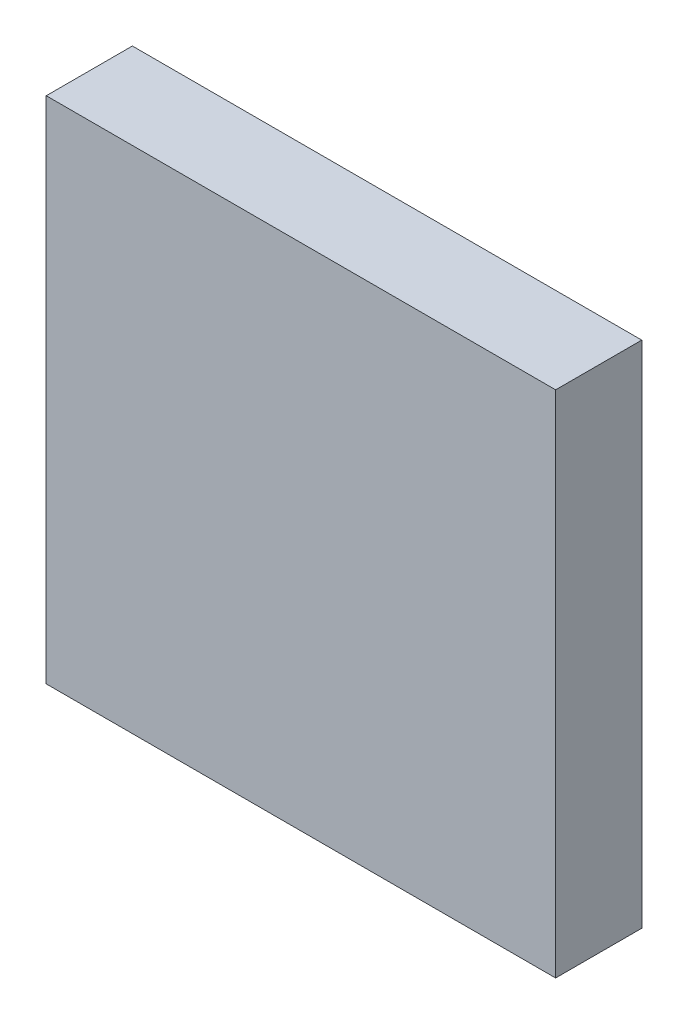
from build123d import *

# Parameters (mm, degrees)
SKETCH1_W           = 215.9
SKETCH1_H           = 215.9
BOSS_EXTRUDE1_DEPTH = 36.5


with BuildPart() as part:
    # Sketch1 → Boss-Extrude1 (new body)
    with BuildSketch(Plane.XY):
        with Locations((-37.341194969, -38.868789308)):
            Rectangle(SKETCH1_W, SKETCH1_H)
    extrude(amount=BOSS_EXTRUDE1_DEPTH)


solid = part.part
